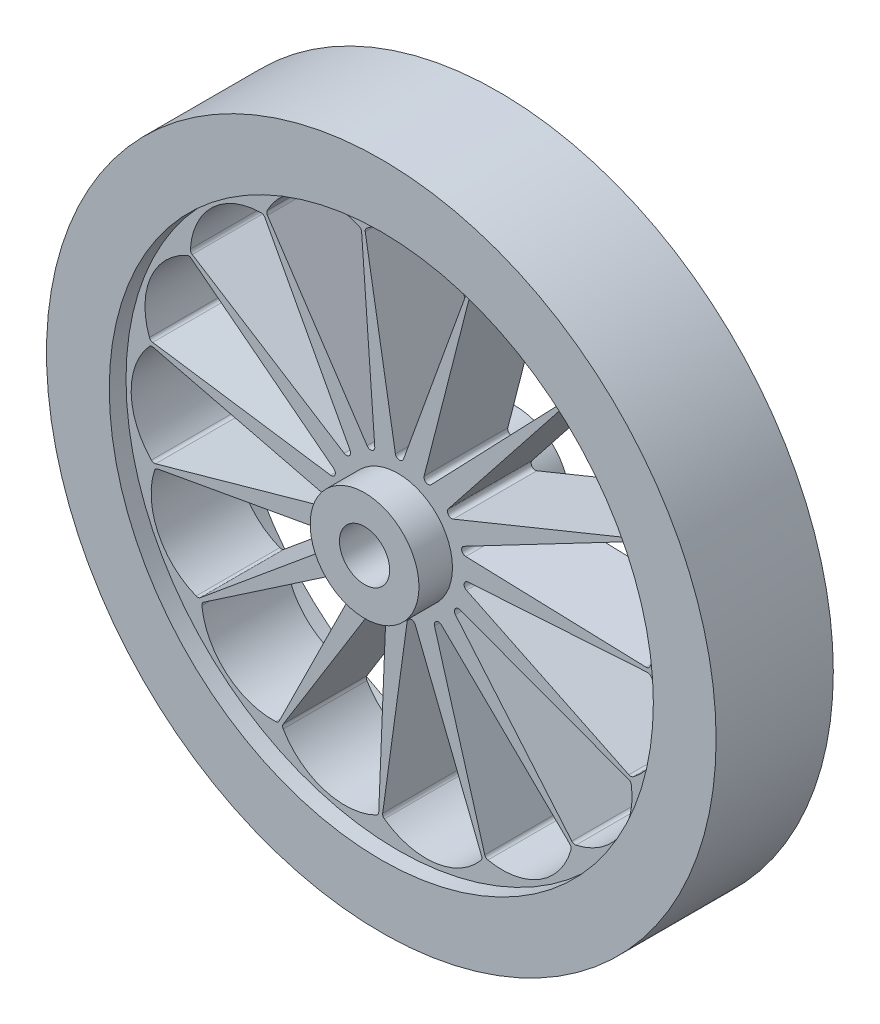
from build123d import *

# Parameters (mm, degrees)
CUT_EXTRUDE1_DEPTH      = 117.550418275
CUT_EXTRUDE1_DEPTH_BACK = 117.550418275


with BuildPart() as part:
    # Sketch1 → Revolve1 (revolve)
    with BuildSketch(Plane(origin=(0, 0, 0), x_dir=(0, 0, -1), z_dir=(1, 0, 0)), mode=Mode.PRIVATE) as revolve1_sk:
        Polygon((-14, 80), (14, 80), (14, 65), (10, 65), (10, 13), (18, 13), (18, 6), (-18, 6), (-18, 13), (-10, 13), (-10, 65), (-14, 65), align=None)
    revolve(revolve1_sk.sketch.rotate(Axis((0, 0, 21.009226083), (0, 0, -1)), 90), axis=Axis((0, 0, 21.009226083), (0, 0, -1)))

    # Sketch2 → Cut-Extrude1 (cut, two sides: drawn at the far end of the back side and taken through both)
    with BuildSketch(Plane(origin=(0, 0, -10), x_dir=(-1, 0, 0), z_dir=(0, 0, -1)).offset(-CUT_EXTRUDE1_DEPTH_BACK)):
        with BuildLine():
            Line((0.637719681, 16.747637536), (7.842487003, 59.087331998))
            ThreePointArc((7.842487003, 59.087331998), (7.789998599, 59.614078882), (7.47597205, 60.040229838))
            ThreePointArc((7.47597205, 60.040229838), (-4.486988844, 63.647600818), (-15.699134285, 58.13277051))
            ThreePointArc((-15.699134285, 58.13277051), (-15.940556782, 57.654586316), (-15.900550292, 57.120409916))
            Line((-15.900550292, 57.120409916), (-1.288879604, 16.576347699))
            ThreePointArc((-1.288879604, 16.576347699), (-0.259550601, 15.919320899), (0.637719681, 16.747637536))
        make_face()
        with BuildLine():
            Line((7.394463789, 15.040344235), (31.197451444, 50.789136914))
            ThreePointArc((31.197451444, 50.789136914), (31.36374816, 51.291693094), (31.250201842, 51.80872747))
            ThreePointArc((31.250201842, 51.80872747), (21.78874322, 59.969999397), (9.302855115, 59.492341617))
            ThreePointArc((9.302855115, 59.492341617), (8.887809655, 59.153693995), (8.707088287, 58.649427466))
            Line((8.707088287, 58.649427466), (5.56475791, 15.667481708))
            ThreePointArc((5.56475791, 15.667481708), (6.23785987, 14.648592036), (7.394463789, 15.040344235))
        make_face()
        with BuildLine():
            Line((12.872637931, 10.732438778), (49.15809311, 33.709038652))
            ThreePointArc((49.15809311, 33.709038652), (49.514420733, 34.1005076), (49.620987836, 34.619025454))
            ThreePointArc((49.620987836, 34.619025454), (44.297003636, 45.92304027), (32.696296351, 50.565146389))
            ThreePointArc((32.696296351, 50.565146389), (32.17939306, 50.424590588), (31.809192199, 50.037426194))
            Line((31.809192199, 50.037426194), (11.456198227, 12.049565795))
            ThreePointArc((11.456198227, 12.049565795), (11.6566877, 10.844988532), (12.872637931, 10.732438778))
        make_face()
        with BuildLine():
            Line((16.12501603, 4.568797156), (58.618853889, 10.800341371))
            ThreePointArc((58.618853889, 10.800341371), (59.103600137, 11.013034549), (59.411854241, 11.443379433))
            ThreePointArc((59.411854241, 11.443379433), (59.145909698, 23.935570282), (50.436250912, 32.894777979))
            ThreePointArc((50.436250912, 32.894777979), (49.906867064, 32.976617376), (49.411197804, 32.773499358))
            Line((49.411197804, 32.773499358), (15.366757794, 6.348170489))
            ThreePointArc((15.366757794, 6.348170489), (15.05996833, 5.166187987), (16.12501603, 4.568797156))
        make_face()
        with BuildLine():
            Line((16.589232367, -2.384831001), (57.943882296, -13.975833051))
            ThreePointArc((57.943882296, -13.975833051), (58.473230137, -13.978692226), (58.929871308, -13.710930852))
            ThreePointArc((58.929871308, -13.710930852), (63.767950649, -2.190577255), (59.455319492, 9.536603618))
            ThreePointArc((59.455319492, 9.536603618), (59.004990363, 9.826687436), (58.469558421, 9.842736744))
            Line((58.469558421, 9.842736744), (16.620265336, -0.450881165))
            ThreePointArc((16.620265336, -0.450881165), (15.859243619, -1.405893394), (16.589232367, -2.384831001))
        make_face()
        with BuildLine():
            Line((14.185019719, -8.926100213), (47.24988705, -36.335458973))
            ThreePointArc((47.24988705, -36.335458973), (47.732307435, -36.553376123), (48.258378264, -36.494496632))
            ThreePointArc((48.258378264, -36.494496632), (57.36393362, -27.937954084), (58.194023196, -15.470536147))
            ThreePointArc((58.194023196, -15.470536147), (57.900614785, -15.022366034), (57.418001208, -14.789924471))
            Line((57.418001208, -14.789924471), (14.999978011, -7.17197137))
            ThreePointArc((14.999978011, -7.17197137), (13.91631161, -7.734883035), (14.185019719, -8.926100213))
        make_face()
        with BuildLine():
            Line((9.328088295, -13.923965606), (28.385957082, -52.412353941))
            ThreePointArc((28.385957082, -52.412353941), (28.738035143, -52.807649211), (29.242573206, -52.967832403))
            ThreePointArc((29.242573206, -52.967832403), (41.041171333, -48.854604843), (46.870451614, -37.802679666))
            ThreePointArc((46.870451614, -37.802679666), (46.7846969, -37.273915943), (46.43834996, -36.865273382))
            Line((46.43834996, -36.865273382), (10.786058217, -12.65296257))
            ThreePointArc((10.786058217, -12.65296257), (9.567122898, -12.726441131), (9.328088295, -13.923965606))
        make_face()
        with BuildLine():
            Line((2.858245661, -16.514250851), (4.613837255, -59.426676761))
            ThreePointArc((4.613837255, -59.426676761), (4.774695497, -59.931000008), (5.170461579, -60.282548753))
            ThreePointArc((5.170461579, -60.282548753), (17.622017675, -61.323850595), (27.442553143, -53.598396444))
            ThreePointArc((27.442553143, -53.598396444), (27.579279895, -53.080467163), (27.429086125, -52.566281616))
            Line((27.429086125, -52.566281616), (4.70713097, -15.946141593))
            ThreePointArc((4.70713097, -15.946141593), (3.563691723, -15.517481939), (2.858245661, -16.514250851))
        make_face()
        with BuildLine():
            Line((-4.105813613, -16.249072097), (-19.956056948, -56.165587294))
            ThreePointArc((-19.956056948, -56.165587294), (-20.014232376, -56.691736448), (-19.795669826, -57.173864775))
            ThreePointArc((-19.795669826, -57.173864775), (-8.84414293, -63.189645469), (3.269587926, -60.126463551))
            ThreePointArc((3.269587926, -60.126463551), (3.605154846, -59.708923389), (3.677084113, -59.178102208))
            Line((3.677084113, -59.178102208), (-2.185701986, -16.482087868))
            ThreePointArc((-2.185701986, -16.482087868), (-3.055934127, -15.625409147), (-4.105813613, -16.249072097))
        make_face()
        with BuildLine():
            Line((-10.359940414, -13.174281159), (-41.07536761, -43.192957537))
            ThreePointArc((-41.07536761, -43.192957537), (-41.342517649, -43.649956627), (-41.338950081, -44.179300168))
            ThreePointArc((-41.338950081, -44.179300168), (-33.781070876, -54.129376582), (-21.468718747, -56.258118879))
            ThreePointArc((-21.468718747, -56.258118879), (-20.992334227, -56.013164323), (-20.710719147, -55.557491313))
            Line((-20.710719147, -55.557491313), (-8.700607211, -14.168131416))
            ThreePointArc((-8.700607211, -14.168131416), (-9.147161204, -13.031561162), (-10.359940414, -13.174281159))
        make_face()
        with BuildLine():
            Line((-14.8227394, -7.821537324), (-55.092374054, -22.751873025))
            ThreePointArc((-55.092374054, -22.751873025), (-55.522306034, -23.060702758), (-55.734350314, -23.545733206))
            ThreePointArc((-55.734350314, -23.545733206), (-52.876944776, -35.709646734), (-42.494888911, -42.662234363))
            ThreePointArc((-42.494888911, -42.662234363), (-41.960058003, -42.632220281), (-41.517450915, -42.330485445))
            Line((-41.517450915, -42.330485445), (-13.711098407, -9.404376329))
            ThreePointArc((-13.711098407, -9.404376329), (-13.656761009, -8.184437864), (-14.8227394, -7.821537324))
        make_face()
        with BuildLine():
            Line((-16.722552084, -1.116378629), (-59.583408526, 1.623217027))
            ThreePointArc((-59.583408526, 1.623217027), (-60.101783302, 1.515956117), (-60.492775047, 1.159104933))
            ThreePointArc((-60.492775047, 1.159104933), (-62.829914552, -11.115394554), (-56.173306729, -21.689661952))
            ThreePointArc((-56.173306729, -21.689661952), (-55.672506555, -21.879778052), (-55.145438246, -21.784154084))
            Line((-55.145438246, -21.784154084), (-16.350816127, -3.014519138))
            ThreePointArc((-16.350816127, -3.014519138), (-15.804982768, -1.922150906), (-16.722552084, -1.116378629))
        make_face()
        with BuildLine():
            Line((-15.730883592, 5.781812073), (-53.771930365, 25.717638108))
            ThreePointArc((-53.771930365, 25.717638108), (-54.28911623, 25.830492408), (-54.791449415, 25.6635233))
            ThreePointArc((-54.791449415, 25.6635233), (-61.91902131, 15.400810325), (-60.138849494, 3.033250056))
            ThreePointArc((-60.138849494, 3.033250056), (-59.758672955, 2.655876574), (-59.238278324, 2.528855421))
            Line((-59.238278324, 2.528855421), (-16.163329196, 3.896575798))
            ThreePointArc((-16.163329196, 3.896575798), (-15.220379423, 4.672493406), (-15.730883592, 5.781812073))
        make_face()
        with BuildLine():
            Line((-12.019202417, 11.680274941), (-38.662796942, 45.365245923))
            ThreePointArc((-38.662796942, 45.365245923), (-39.08936776, 45.678701899), (-39.616184414, 45.730485342))
            ThreePointArc((-39.616184414, 45.730485342), (-50.301766767, 39.254075187), (-53.705838838, 27.231685572))
            ThreePointArc((-53.705838838, 27.231685572), (-53.512021911, 26.732306013), (-53.088281917, 26.40460285))
            Line((-53.088281917, 26.40460285), (-13.181055808, 10.133917379))
            ThreePointArc((-13.181055808, 10.133917379), (-12.004034203, 10.45922116), (-12.019202417, 11.680274941))
        make_face()
        with BuildLine():
            Line((-6.229291953, 15.55911216), (-16.868514687, 57.168790588))
            ThreePointArc((-16.868514687, 57.168790588), (-17.130712489, 57.628648854), (-17.590921227, 57.89023102))
            ThreePointArc((-17.590921227, 57.89023102), (-29.986879773, 56.319953837), (-37.986600745, 46.721515261))
            ThreePointArc((-37.986600745, 46.721515261), (-38.012656136, 46.186476887), (-37.758839274, 45.714754568))
            Line((-37.758839274, 45.714754568), (-7.919658125, 14.619012581))
            ThreePointArc((-7.919658125, 14.619012581), (-6.712082415, 14.437454556), (-6.229291953, 15.55911216))
        make_face()
    extrude(amount=CUT_EXTRUDE1_DEPTH + CUT_EXTRUDE1_DEPTH_BACK, mode=Mode.SUBTRACT)


solid = part.part
